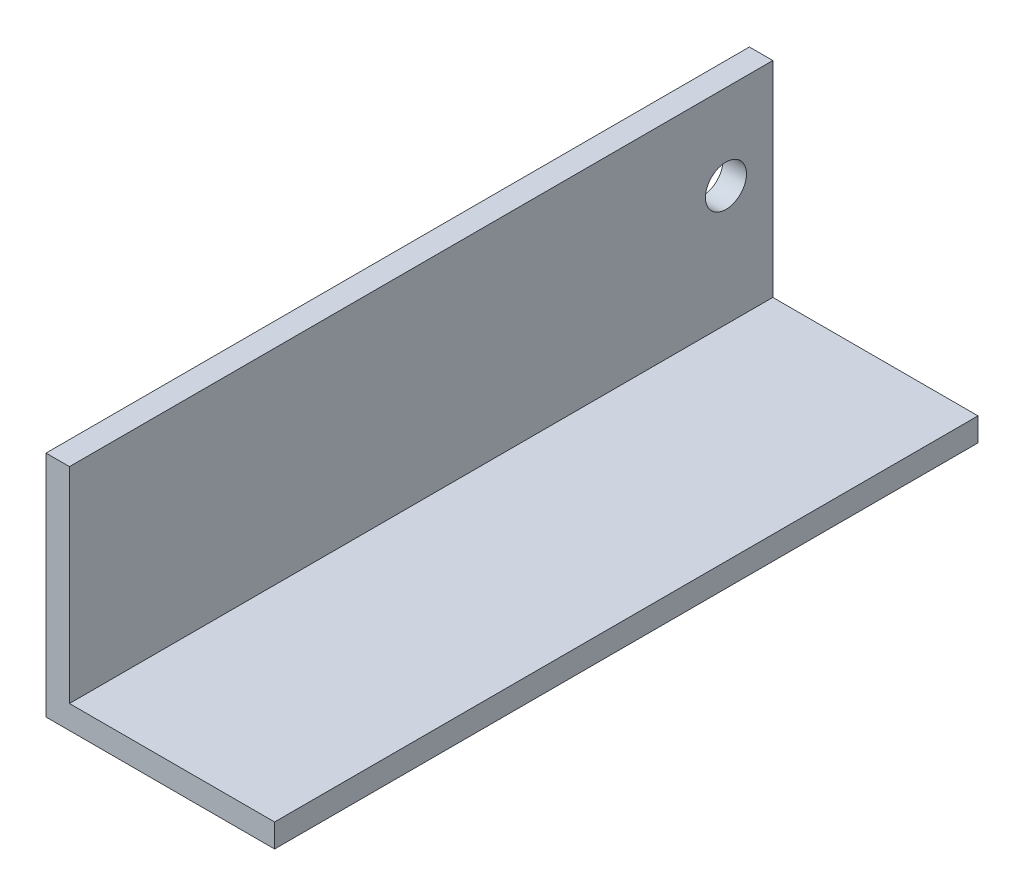
from build123d import *

# Parameters (mm, degrees)
BOSS_EXTRUDE1_DEPTH = 60
SKETCH2_R           = 1.75
CUT_EXTRUDE1_DEPTH  = 66.471367788


with BuildPart() as part:
    # Sketch1 → Boss-Extrude1 (new body)
    with BuildSketch(Plane.XY):
        Polygon((0, 0), (0, 19.5), (2, 19.5), (2, 2), (19.5, 2), (19.5, 0), align=None)
    extrude(amount=BOSS_EXTRUDE1_DEPTH)

    # Sketch2 → Cut-Extrude1 (cut, through all)
    with BuildSketch(Plane(origin=(2, 0, 0), x_dir=(0, 0, -1), z_dir=(1, 0, 0))):
        with Locations(Location((-4, 12.25, 0), (0, 0, 90))):
            Circle(SKETCH2_R)
    extrude(amount=-CUT_EXTRUDE1_DEPTH, mode=Mode.SUBTRACT)


solid = part.part
